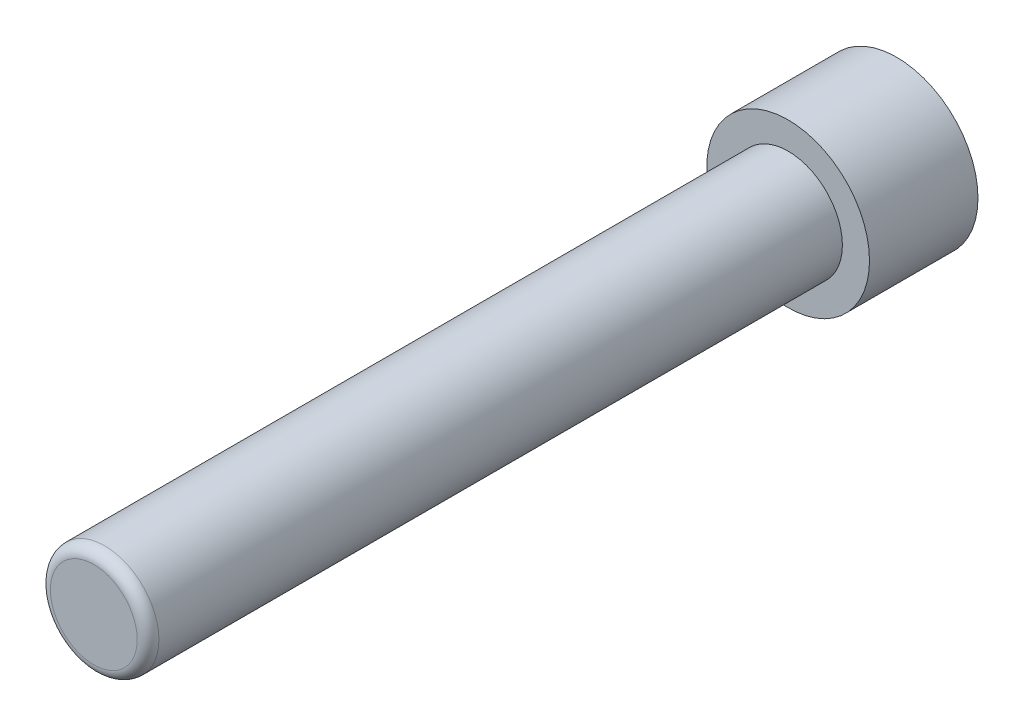
from build123d import *

# Parameters (mm, degrees)
SKETCH1_R           = 3.81
BOSS_EXTRUDE1_DEPTH = 5.08
SKETCH2_R           = 2.54
BOSS_EXTRUDE2_DEPTH = 32.512
FILLET1_R           = 0.508


with BuildPart() as part:
    # Sketch1 → Boss-Extrude1 (new body)
    with BuildSketch(Plane.XY):
        Circle(SKETCH1_R)
        Polygon((1.905, 1.099852263), (0, 2.199704526), (-1.905, 1.099852263), (-1.905, -1.099852263), (0, -2.199704526), (1.905, -1.099852263), align=None, mode=Mode.SUBTRACT)
    extrude(amount=BOSS_EXTRUDE1_DEPTH)

    # Sketch2 → Boss-Extrude2 (add)
    with BuildSketch(Plane.XY.offset(5.08)):
        Circle(SKETCH2_R)
    extrude(amount=BOSS_EXTRUDE2_DEPTH)

    # Fillet1
    fillet1_edges = [part.edges().sort_by_distance(p)[0] for p in [
        (-2.54, 0, 37.592),
    ]]
    fillet(fillet1_edges, radius=FILLET1_R)


solid = part.part
